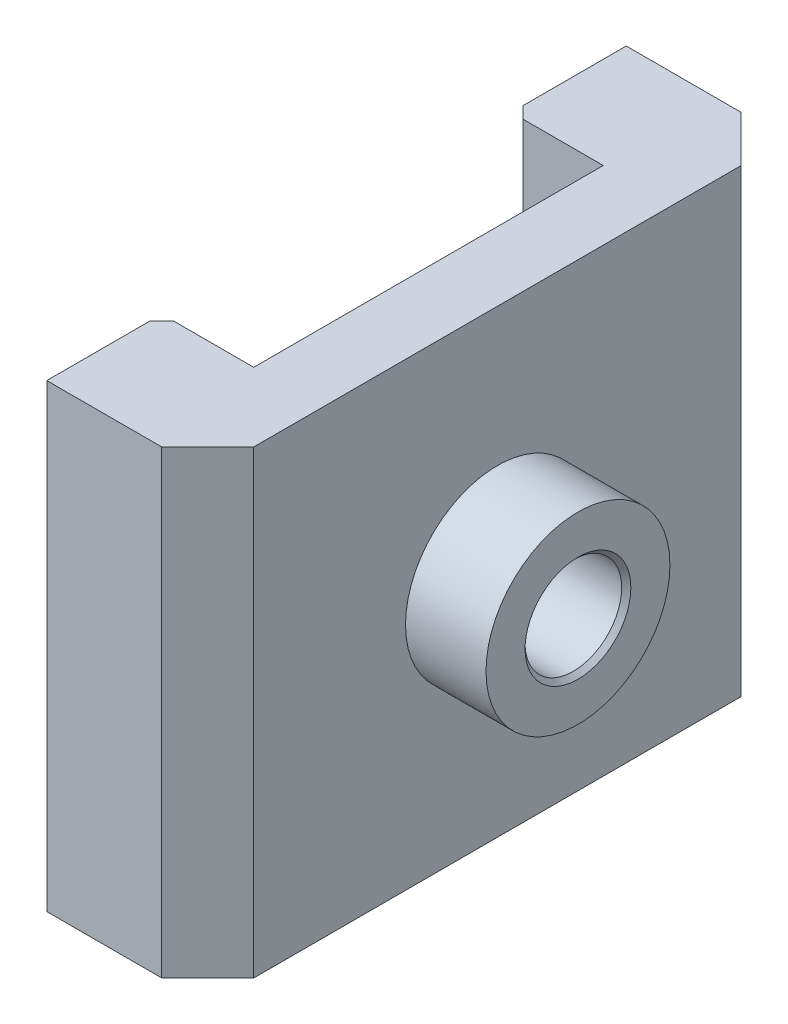
from build123d import *

# Parameters (mm, degrees)
EXTRUDE_1_DEPTH     = 20
CHAMFER_1_SIZE      = 2
SKETCH_2_R          = 4
EXTRUDE_2_DEPTH     = 3.5
SKETCH_3_R          = 2.1
CUT_EXTRUDE_1_DEPTH = 26.865227623
CHAMFER_2_SIZE      = 0.2
CHAMFER_3_SIZE      = 0.5


with BuildPart() as part:
    # 草图1 → 凸台-拉伸1 (new body)
    with BuildSketch(Plane(origin=(0, 0, 0), x_dir=(1, 0, 0), z_dir=(0, 1, 0))):
        Polygon((-7, 12.6), (0, 12.6), (0, -12.6), (-7, -12.6), (-7, -7.6), (-3, -7.6), (-3, 7.6), (-7, 7.6), align=None)
    extrude(amount=EXTRUDE_1_DEPTH)

    # 倒角1
    chamfer_1_edges = [part.edges().sort_by_distance(p)[0] for p in [
        (0, 10, -12.6),
        (0, 10, 12.6),
    ]]
    chamfer(chamfer_1_edges, length=CHAMFER_1_SIZE)

    # 草图2 → 凸台-拉伸2 (add)
    with BuildSketch(Plane(origin=(0, 0, 0), x_dir=(0, 0, -1), z_dir=(1, 0, 0))):
        with Locations(Location((0, 10, 0), (0, 0, 180))):
            Circle(SKETCH_2_R)
    extrude(amount=EXTRUDE_2_DEPTH)

    # 草图3 → 切除-拉伸1 (cut, through all)
    with BuildSketch(Plane(origin=(3.5, 0, 0), x_dir=(0, 0, -1), z_dir=(1, 0, 0))):
        with Locations((0, 10)):
            Circle(SKETCH_3_R)
    extrude(amount=-CUT_EXTRUDE_1_DEPTH, mode=Mode.SUBTRACT)

    # 倒角2
    chamfer_2_edges = [part.edges().sort_by_distance(p)[0] for p in [
        (3.5, 10, 2.1),
    ]]
    chamfer(chamfer_2_edges, length=CHAMFER_2_SIZE)

    # 倒角3
    chamfer_3_edges = [part.edges().sort_by_distance(p)[0] for p in [
        (-7, 10, 7.6),
        (-7, 10, -7.6),
    ]]
    chamfer(chamfer_3_edges, length=CHAMFER_3_SIZE)


solid = part.part
